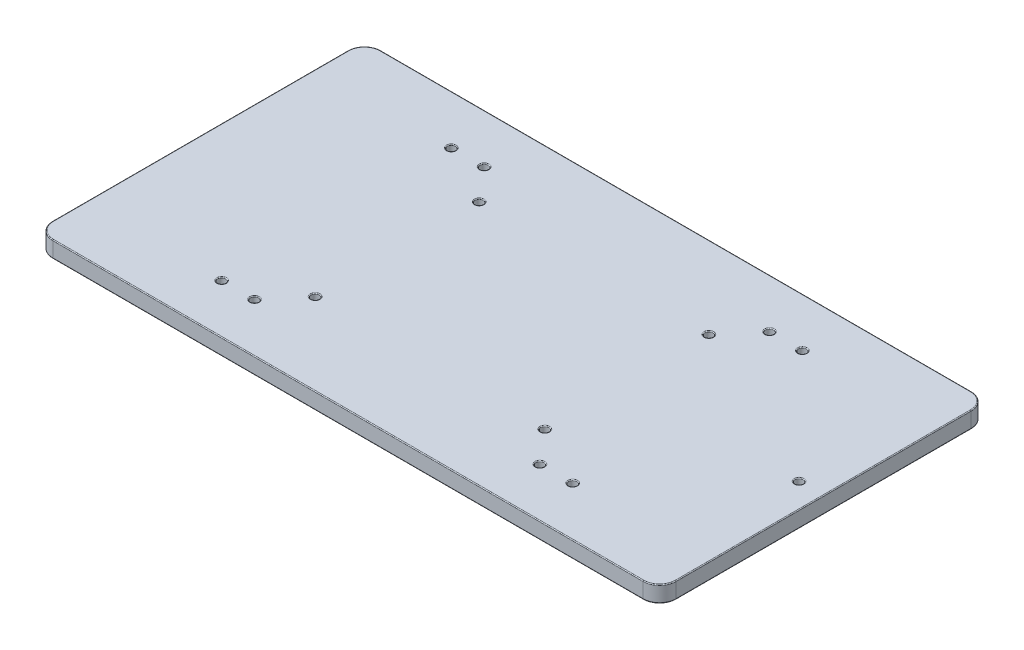
from build123d import *

# Parameters (mm, degrees)
SKETCH1_W           = 190
SKETCH1_H           = 100
SKETCH1_R           = 1.25
BOSS_EXTRUDE1_DEPTH = 5
FILLET2_R           = 5
FILLET3_R           = 0.25


with BuildPart() as part:
    # Sketch1 → Boss-Extrude1 (new body)
    with BuildSketch(Plane(origin=(0, 0, 0), x_dir=(1, 0, 0), z_dir=(0, 1, 0))):
        Rectangle(SKETCH1_W, SKETCH1_H)
        with Locations(Location((-35, 25, 0), (0, 0, 270))):
            Circle(SKETCH1_R, mode=Mode.SUBTRACT)
        with Locations(Location((35, -25, 0), (0, 0, 270))):
            Circle(SKETCH1_R, mode=Mode.SUBTRACT)
        with Locations(Location((-35, -25, 0), (0, 0, 270))):
            Circle(SKETCH1_R, mode=Mode.SUBTRACT)
        with Locations(Location((35, 25, 0), (0, 0, 270))):
            Circle(SKETCH1_R, mode=Mode.SUBTRACT)
        with Locations(Location((87.5, 0, 0), (0, 0, 270))):
            Circle(SKETCH1_R, mode=Mode.SUBTRACT)
        with Locations(Location((-53.5, -35, 0), (0, 0, 270))):
            Circle(SKETCH1_R, mode=Mode.SUBTRACT)
        with Locations(Location((-43.5, -35, 0), (0, 0, 270))):
            Circle(SKETCH1_R, mode=Mode.SUBTRACT)
        with Locations(Location((-43.5, 35, 0), (0, 0, 90))):
            Circle(SKETCH1_R, mode=Mode.SUBTRACT)
        with Locations(Location((-53.5, 35, 0), (0, 0, 90))):
            Circle(SKETCH1_R, mode=Mode.SUBTRACT)
        with Locations(Location((43.5, -35, 0), (0, 0, 90))):
            Circle(SKETCH1_R, mode=Mode.SUBTRACT)
        with Locations(Location((53.5, -35, 0), (0, 0, 90))):
            Circle(SKETCH1_R, mode=Mode.SUBTRACT)
        with Locations(Location((43.5, 35, 0), (0, 0, 270))):
            Circle(SKETCH1_R, mode=Mode.SUBTRACT)
        with Locations(Location((53.5, 35, 0), (0, 0, 270))):
            Circle(SKETCH1_R, mode=Mode.SUBTRACT)
    extrude(amount=BOSS_EXTRUDE1_DEPTH)

    # Fillet2
    fillet2_edges = [part.edges().sort_by_distance(p)[0] for p in [
        (95, 2.5, 50),
        (-95, 2.5, 50),
        (-95, 2.5, -50),
        (95, 2.5, -50),
    ]]
    fillet(fillet2_edges, radius=FILLET2_R)

    # Fillet3
    fillet3_edges = [part.edges().sort_by_distance(p)[0] for p in [
        (-35, 0, -26.25),
        (-35, 5, -26.25),
        (35, 0, -26.25),
        (35, 5, -26.25),
        (35, 0, 23.75),
        (35, 5, 23.75),
        (-35, 0, 23.75),
        (-35, 5, 23.75),
        (87.5, 0, -1.25),
        (87.5, 5, -1.25),
        (-53.5, 0, 33.75),
        (-53.5, 5, 33.75),
        (-43.5, 0, 33.75),
        (-43.5, 5, 33.75),
        (-43.5, 0, -33.75),
        (-43.5, 5, -33.75),
        (-53.5, 0, -33.75),
        (-53.5, 5, -33.75),
        (43.5, 0, 36.25),
        (43.5, 5, 36.25),
        (53.5, 0, 36.25),
        (53.5, 5, 36.25),
        (43.5, 0, -36.25),
        (43.5, 5, -36.25),
        (53.5, 0, -36.25),
        (53.5, 5, -36.25),
        (0, 0, 50),
        (0, 5, 50),
        (95, 0, 0),
        (-95, 0, 0),
        (0, 0, -50),
        (93.535533906, 0, 48.535533906),
        (93.535533906, 0, -48.535533906),
        (-93.535533906, 0, -48.535533906),
        (-93.535533906, 0, 48.535533906),
        (-95, 5, 0),
        (95, 5, 0),
        (0, 5, -50),
        (93.535533906, 5, 48.535533906),
        (93.535533906, 5, -48.535533906),
        (-93.535533906, 5, -48.535533906),
        (-93.535533906, 5, 48.535533906),
    ]]
    fillet(fillet3_edges, radius=FILLET3_R)


solid = part.part
